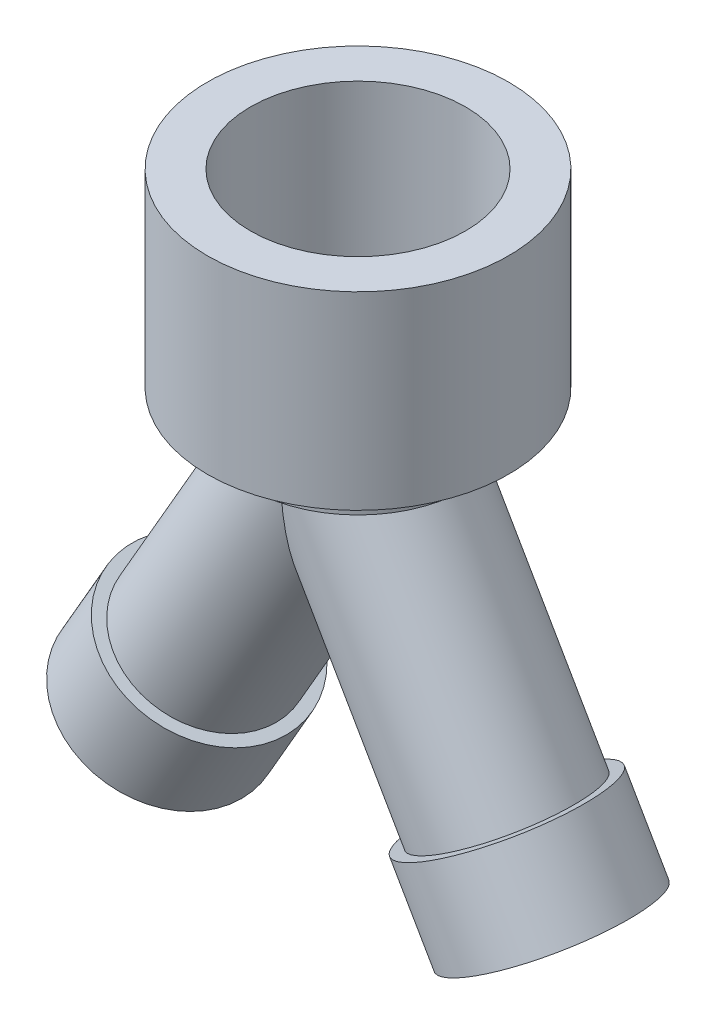
from build123d import *

# Parameters (mm, degrees)
SKETCH1_R           = 22.225
SKETCH1_R_2         = 15.875
BOSS_EXTRUDE1_DEPTH = 25.4
BOSS_EXTRUDE2_START = 2.54
SKETCH2_R           = 22.225
BOSS_EXTRUDE2_DEPTH = 2.54
BOSS_EXTRUDE3_START = 5.08
SKETCH3_R           = 15.875
BOSS_EXTRUDE3_DEPTH = 5.08
BOSS_EXTRUDE4_START = -13.208
SKETCH5_R           = 13.15140871
SKETCH5_R_2         = 11.43
BOSS_EXTRUDE4_DEPTH = 13.208


with BuildPart() as part:
    # Sketch1 → Boss-Extrude1 (new body)
    with BuildSketch(Plane(origin=(0, 0, 0), x_dir=(1, 0, 0), z_dir=(0, 1, 0))):
        with Locations(Location((0, 0, 0), (0, 0, 270))):
            Circle(SKETCH1_R)
        with Locations(Location((0, 0, 0), (0, 0, 270))):
            Circle(SKETCH1_R_2, mode=Mode.SUBTRACT)
    extrude(amount=BOSS_EXTRUDE1_DEPTH)

    # Sketch2 → Boss-Extrude2 (add)
    with BuildSketch(Plane.XZ.offset(BOSS_EXTRUDE2_START)):
        with Locations(Location((0, 0, 0), (0, 0, 270))):
            Circle(SKETCH2_R)
    extrude(amount=-BOSS_EXTRUDE2_DEPTH)

    # Sketch3 → Boss-Extrude3 (add)
    with BuildSketch(Plane.XZ.offset(2.54).offset(BOSS_EXTRUDE3_START)):
        with Locations(Location((0, 0, 0), (0, 0, 90))):
            Circle(SKETCH3_R)
    extrude(amount=-BOSS_EXTRUDE3_DEPTH)

    # Sketch4 → Revolve1 (revolve)
    with BuildSketch(Plane.XY):
        Polygon((-38.473670365, -51.398351826), (-9.898670365, -1.905), (-6.599113577, -3.81), (-35.174113577, -53.303351826), align=None)
    revolve1 = revolve(axis=Axis((0, -7.62, 0), (-0.500000000000001, -0.8660254037844382, 0)))

    # Sketch5 → Boss-Extrude4 (add)
    with BuildSketch(Plane(origin=(-31.874556788, -55.208351826, 0), x_dir=(0.866025403784438, -0.5000000000000012, 0), z_dir=(-0.5000000000000011, -0.8660254037844379, 0)).offset(BOSS_EXTRUDE4_START)):
        with Locations((3.81, 0)):
            Circle(SKETCH5_R)
        with Locations(Location((3.81, 0, 0), (0, 0, 90))):
            Circle(SKETCH5_R_2, mode=Mode.SUBTRACT)
    boss_extrude4 = extrude(amount=BOSS_EXTRUDE4_DEPTH)

    # Mirror1: Revolve1, Boss-Extrude4 across plane
    add(revolve1.mirror(Plane(origin=(0, 0, 0), x_dir=(0, 0, 1), z_dir=(1, 0, 0))))
    add(boss_extrude4.mirror(Plane(origin=(0, 0, 0), x_dir=(0, 0, 1), z_dir=(1, 0, 0))))


solid = part.part
